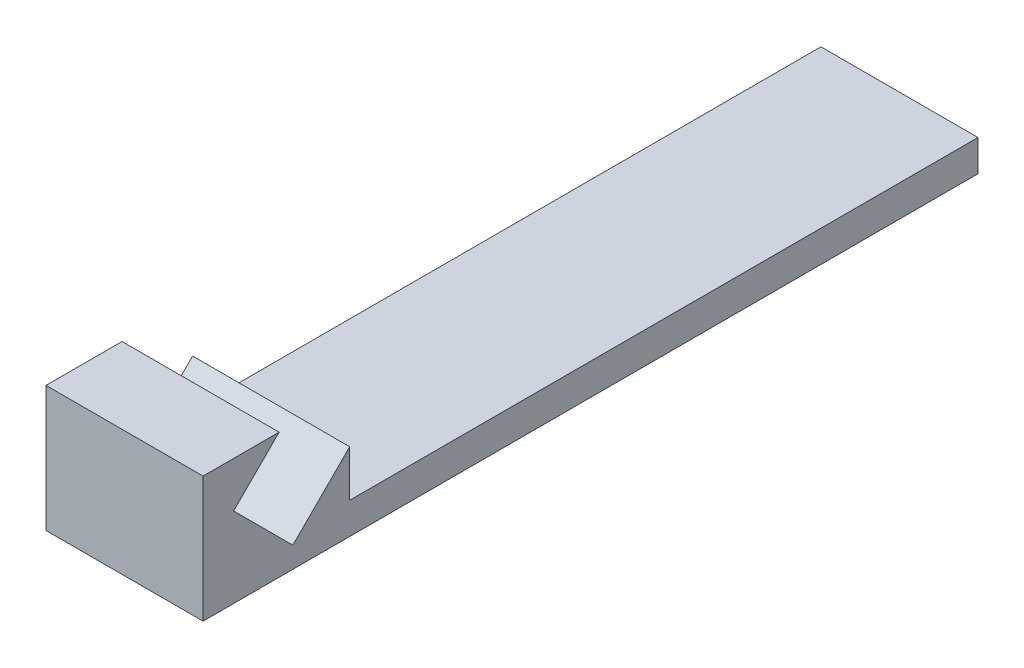
from build123d import *

# Parameters (mm, degrees)
SKETCH1_W           = 14
SKETCH1_H           = 12
SKETCH1_W_2         = 60
SKETCH1_H_2         = 3
BOSS_EXTRUDE1_DEPTH = 15
CUT_EXTRUDE1_DEPTH  = 63.497999968


with BuildPart() as part:
    # Sketch1 → Boss-Extrude1 (new body)
    with BuildSketch(Plane(origin=(0, 0, 0), x_dir=(0, 0, -1), z_dir=(1, 0, 0))):
        with Locations((-7, 3)):
            Rectangle(SKETCH1_W, SKETCH1_H)
        with Locations((30, -1.5)):
            Rectangle(SKETCH1_W_2, SKETCH1_H_2)
    extrude(amount=-BOSS_EXTRUDE1_DEPTH)

    # Sketch6 → Cut-Extrude1 (cut, through all)
    with BuildSketch(Plane(origin=(0, 0, 0), x_dir=(0, 0, -1), z_dir=(1, 0, 0))):
        Polygon((0, 4.427403812), (0, 9), (-6.741112311, 9), (-11.084258062, 4.656854249), (-5.427403812, -1), align=None)
    extrude(amount=-CUT_EXTRUDE1_DEPTH, mode=Mode.SUBTRACT)


solid = part.part
